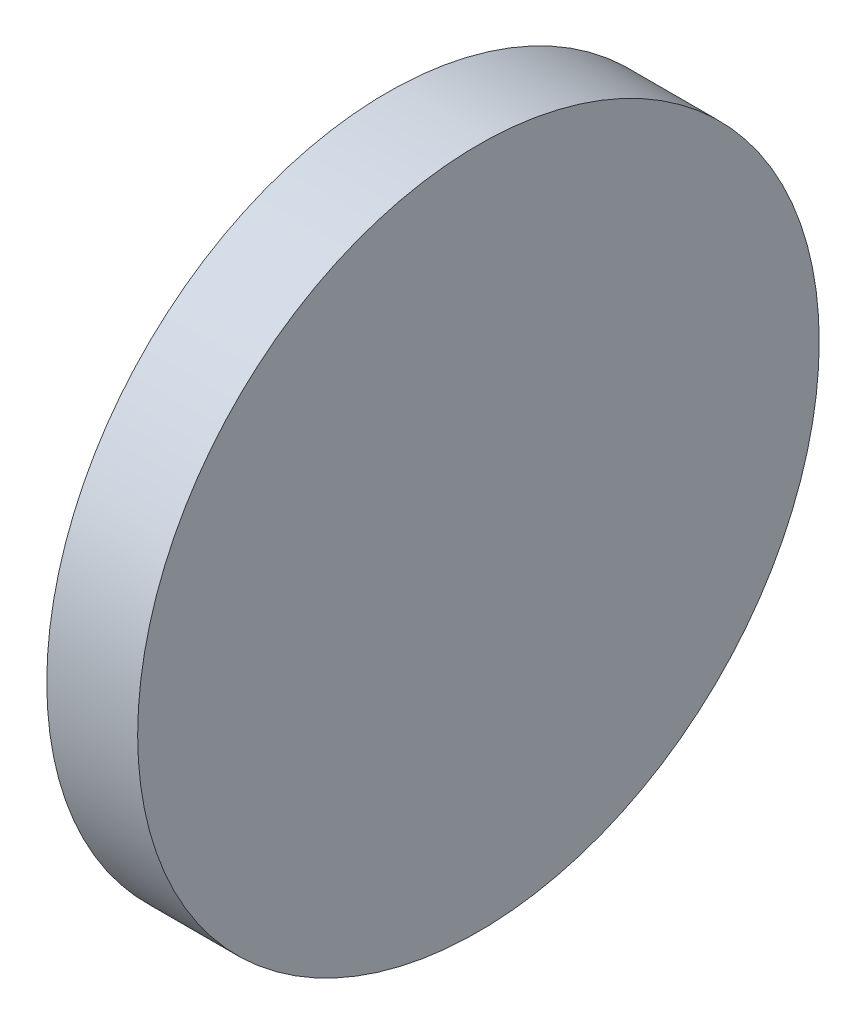
from build123d import *

# Parameters (mm, degrees)
SKETCH1_R           = 7.5
BOSS_EXTRUDE1_DEPTH = 2


with BuildPart() as part:
    # Sketch1 → Boss-Extrude1 (new body)
    with BuildSketch(Plane(origin=(0, 0, 0), x_dir=(0, 0, -1), z_dir=(1, 0, 0))):
        Circle(SKETCH1_R)
    extrude(amount=BOSS_EXTRUDE1_DEPTH)


solid = part.part
